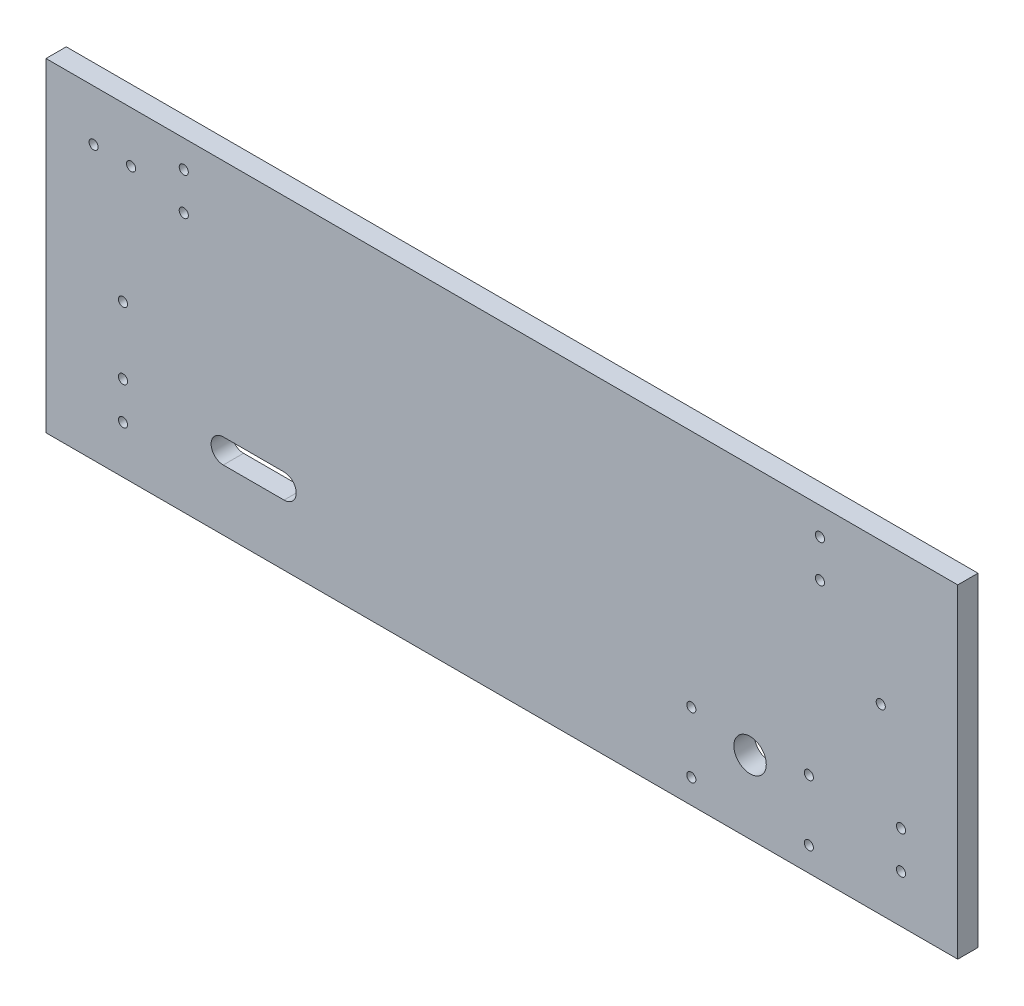
from build123d import *

# Parameters (mm, degrees)
SCHIZZO1_W                   = 450
SCHIZZO1_H                   = 160
ESTRUSIONE_ESTRUSIONE1_DEPTH = 10
SCHIZZO2_R                   = 8
SCHIZZO2_R_2                 = 2.25
TAGLIO_ESTRUSIONE1_DEPTH     = 10


with BuildPart() as part:
    # Schizzo1 → Estrusione-Estrusione1 (new body)
    with BuildSketch(Plane.XY):
        with Locations((225, 80)):
            Rectangle(SCHIZZO1_W, SCHIZZO1_H)
    extrude(amount=ESTRUSIONE_ESTRUSIONE1_DEPTH)

    # Schizzo2 → Taglio-Estrusione1 (cut)
    with BuildSketch(Plane.XY.offset(10)):
        with Locations((347.5, 36)):
            Circle(SCHIZZO2_R)
        with Locations((376.5, 42)):
            Circle(SCHIZZO2_R_2)
        with Locations((376.5, 12)):
            Circle(SCHIZZO2_R_2)
        with Locations((318.5, 12)):
            Circle(SCHIZZO2_R_2)
        with Locations((318.5, 42)):
            Circle(SCHIZZO2_R_2)
        with Locations((68, 146.5)):
            Circle(SCHIZZO2_R_2)
        with Locations((68, 128)):
            Circle(SCHIZZO2_R_2)
        with Locations((382, 146.5)):
            Circle(SCHIZZO2_R_2)
        with Locations((382, 128)):
            Circle(SCHIZZO2_R_2)
        with Locations((38, 42)):
            Circle(SCHIZZO2_R_2)
        with Locations((38, 23.5)):
            Circle(SCHIZZO2_R_2)
        with Locations((422, 42)):
            Circle(SCHIZZO2_R_2)
        with Locations((422, 23.5)):
            Circle(SCHIZZO2_R_2)
        with Locations((23.5, 134.933694222)):
            Circle(SCHIZZO2_R_2)
        with Locations((42, 134.933694222)):
            Circle(SCHIZZO2_R_2)
        with Locations((38, 75)):
            Circle(SCHIZZO2_R_2)
        with Locations((412, 90)):
            Circle(SCHIZZO2_R_2)
        with BuildLine():
            Line((87.5, 42), (117.5, 42))
            ThreePointArc((117.5, 42), (123.5, 36), (117.5, 30))
            Line((117.5, 30), (87.5, 30))
            ThreePointArc((87.5, 30), (81.5, 36), (87.5, 42))
        make_face()
    extrude(amount=-TAGLIO_ESTRUSIONE1_DEPTH, mode=Mode.SUBTRACT)


solid = part.part
